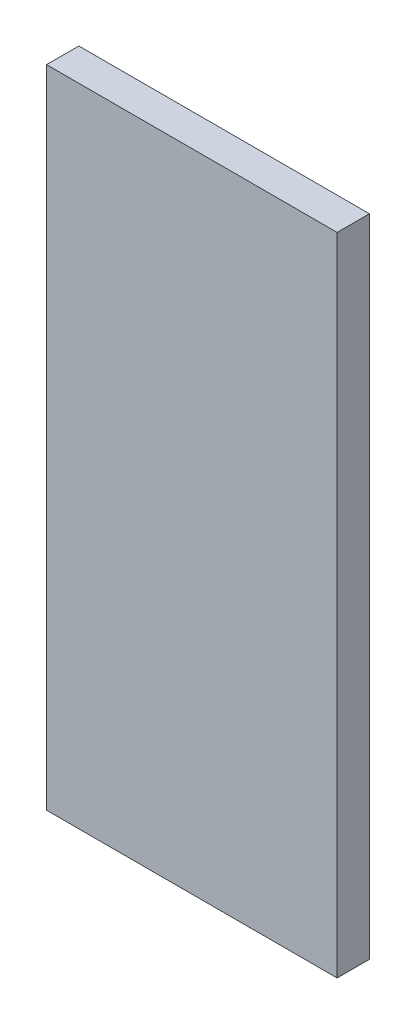
from build123d import *

# Parameters (mm, degrees)
SKETCH1_W           = 45
SKETCH1_H           = 100
BOSS_EXTRUDE1_DEPTH = 5


with BuildPart() as part:
    # Sketch1 → Boss-Extrude1 (new body)
    with BuildSketch(Plane.XY):
        Rectangle(SKETCH1_W, SKETCH1_H)
    extrude(amount=BOSS_EXTRUDE1_DEPTH)


solid = part.part
